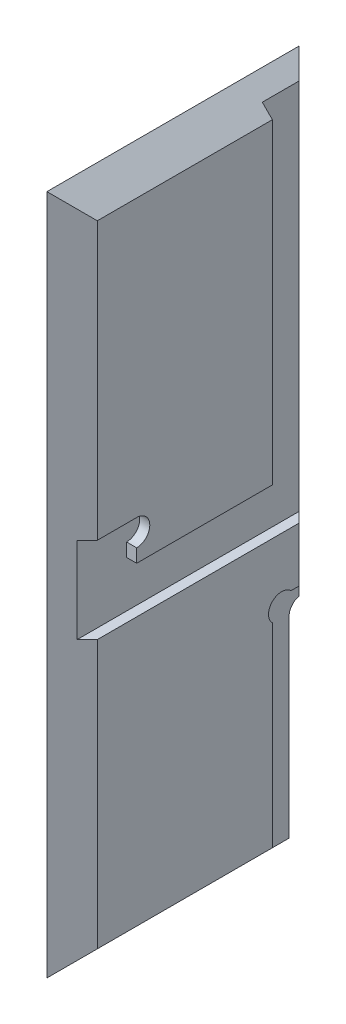
from build123d import *

# Parameters (mm, degrees)
SKETCH1_W               = 127
SKETCH1_H               = 342.9
BOSS_EXTRUDE1_DEPTH     = 12.7
DRAFT1_ANGLE            = -45
CUT_EXTRUDE1_DEPTH      = 184.272045059
CUT_EXTRUDE1_DEPTH_BACK = 5.08
CUT_EXTRUDE2_DEPTH      = 5.08
SKETCH4_W               = 12.7
SKETCH4_H               = 110.871
CUT_EXTRUDE6_DEPTH      = 184.272045059
SKETCH5_W               = 26.162
SKETCH5_H               = 171.958
CUT_EXTRUDE7_DEPTH      = 5.08
FILLET1_R               = 6.604


with BuildPart() as part:
    # Sketch1 → Boss-Extrude1 (new body)
    with BuildSketch(Plane(origin=(0, 0, 0), x_dir=(0, 0, -1), z_dir=(1, 0, 0))):
        Rectangle(SKETCH1_W, SKETCH1_H)
    extrude(amount=BOSS_EXTRUDE1_DEPTH)

    # Draft1
    draft1_faces = [part.faces().sort_by_distance(p)[0] for p in [
        (6.35, -171.45, 0),
        (6.35, 0, -63.5),
        (6.35, 0, 63.5),
        (6.35, 171.45, 0),
    ]]
    draft(draft1_faces, Plane(origin=(0, 0, 0), x_dir=(0, 0, -1), z_dir=(-1, 0, 0)), DRAFT1_ANGLE)

    # Sketch2 → Cut-Extrude1 (cut, two sides: drawn at the far end of the back side and taken through both)
    with BuildSketch(Plane(origin=(12.7, 0, 0), x_dir=(0, 0, -1), z_dir=(1, 0, 0)).offset(-CUT_EXTRUDE1_DEPTH_BACK)):
        with BuildLine():
            Line((-63.5, 19.431), (-30.988, 19.431))
            ThreePointArc((-30.988, 19.431), (-24.384, 12.827), (-30.988, 6.223))
            Line((-30.988, 6.223), (-30.988, -0.508))
            Line((-30.988, -0.508), (63.5, -0.508))
            Line((63.5, -0.508), (63.5, -23.876))
            Line((63.5, -23.876), (-63.5, -23.876))
            Line((-63.5, -23.876), (-63.5, 19.431))
        make_face()
    extrude(amount=CUT_EXTRUDE1_DEPTH + CUT_EXTRUDE1_DEPTH_BACK, mode=Mode.SUBTRACT)

    # Sketch3 → Cut-Extrude2 (cut)
    with BuildSketch(Plane(origin=(12.7, 0, 0), x_dir=(0, 0, -1), z_dir=(1, 0, 0))):
        with BuildLine():
            Line((37.338, -171.45), (63.5, -171.45))
            Line((63.5, -171.45), (63.5, -51.308))
            Line((63.5, -51.308), (46.677466366, -51.308))
            ThreePointArc((46.677466366, -51.308), (37.338, -51.308), (37.338, -60.647466366))
            Line((37.338, -60.647466366), (37.338, -171.45))
        make_face()
    extrude(amount=-CUT_EXTRUDE2_DEPTH, mode=Mode.SUBTRACT)

    # Sketch4 → Cut-Extrude6 (cut, through all)
    with BuildSketch(Plane(origin=(12.7, 0, 0), x_dir=(0, 0, -1), z_dir=(1, 0, 0))):
        with Locations((57.15, -116.0145)):
            Rectangle(SKETCH4_W, SKETCH4_H)
    extrude(amount=-CUT_EXTRUDE6_DEPTH, mode=Mode.SUBTRACT)

    # Sketch5 → Cut-Extrude7 (cut)
    with BuildSketch(Plane(origin=(12.7, 0, 0), x_dir=(0, 0, -1), z_dir=(1, 0, 0))):
        with Locations((50.419, 85.471)):
            Rectangle(SKETCH5_W, SKETCH5_H)
    extrude(amount=-CUT_EXTRUDE7_DEPTH, mode=Mode.SUBTRACT)

    # Fillet1
    fillet1_edges = [part.edges().sort_by_distance(p)[0] for p in [
        (3.81, -60.579, -50.8),
    ]]
    fillet(fillet1_edges, radius=FILLET1_R)


solid = part.part
